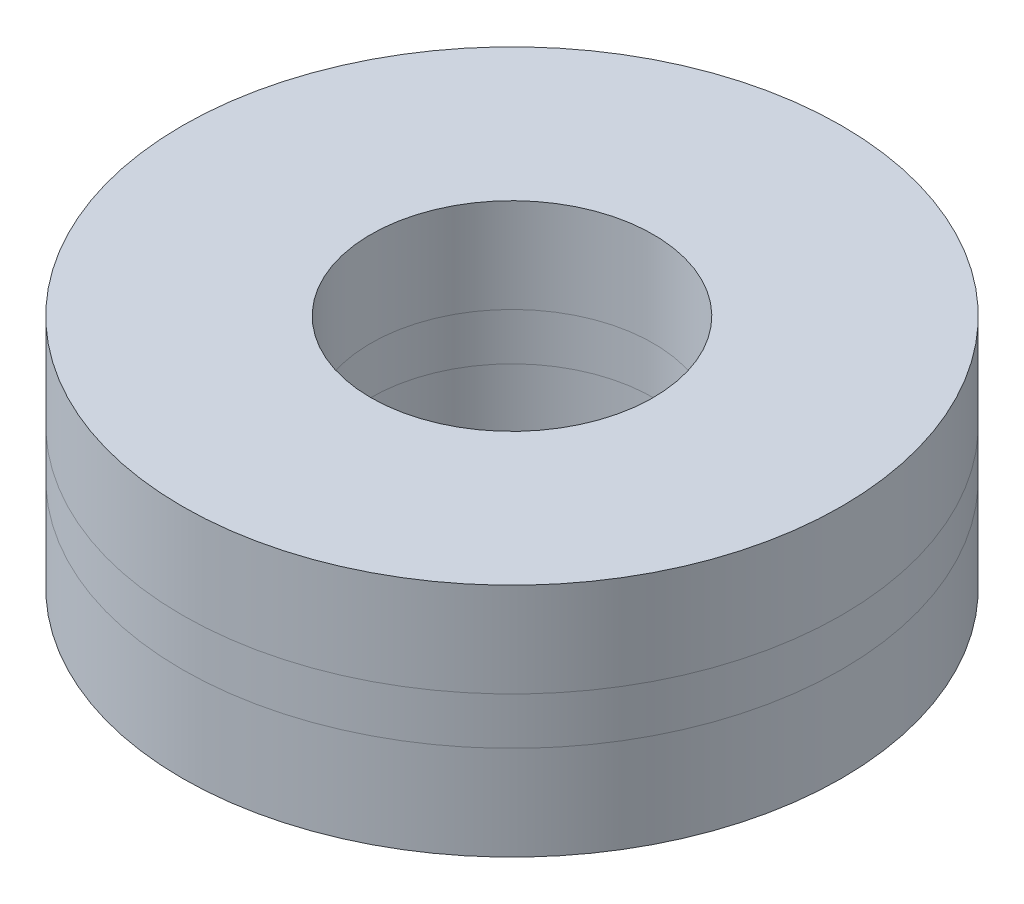
from build123d import *

# Parameters (mm, degrees)
SKETCH_1_R      = 7
SKETCH_1_R_2    = 3
EXTRUDE_1_DEPTH = 2
SKETCH_2_R      = 7
SKETCH_2_R_2    = 3
EXTRUDE_2_DEPTH = 1
SKETCH_3_R      = 7
SKETCH_3_R_2    = 3
EXTRUDE_3_DEPTH = 2


with BuildPart() as part:
    # 草图1 → 凸台-拉伸1 (new body)
    with BuildSketch(Plane(origin=(0, 0, 0), x_dir=(1, 0, 0), z_dir=(0, 1, 0))):
        with Locations(Location((0, 0, 0), (0, 0, 270))):
            Circle(SKETCH_1_R)
        with Locations(Location((0, 0, 0), (0, 0, 270))):
            Circle(SKETCH_1_R_2, mode=Mode.SUBTRACT)
    extrude(amount=EXTRUDE_1_DEPTH)


with BuildPart() as body_2:
    # 草图2 → 凸台-拉伸2 (new body)
    with BuildSketch(Plane(origin=(0, 2, 0), x_dir=(1, 0, 0), z_dir=(0, 1, 0))):
        with Locations(Location((0, 0, 0), (0, 0, 270))):
            Circle(SKETCH_2_R)
        with Locations(Location((0, 0, 0), (0, 0, 270))):
            Circle(SKETCH_2_R_2, mode=Mode.SUBTRACT)
    extrude(amount=EXTRUDE_2_DEPTH)


with BuildPart() as body_3:
    # 草图3 → 凸台-拉伸3 (new body)
    with BuildSketch(Plane(origin=(0, 3, 0), x_dir=(1, 0, 0), z_dir=(0, 1, 0))):
        with Locations(Location((0, 0, 0), (0, 0, 270))):
            Circle(SKETCH_3_R)
        with Locations(Location((0, 0, 0), (0, 0, 270))):
            Circle(SKETCH_3_R_2, mode=Mode.SUBTRACT)
    extrude(amount=EXTRUDE_3_DEPTH)


solid = Compound([part.part, body_2.part, body_3.part])
